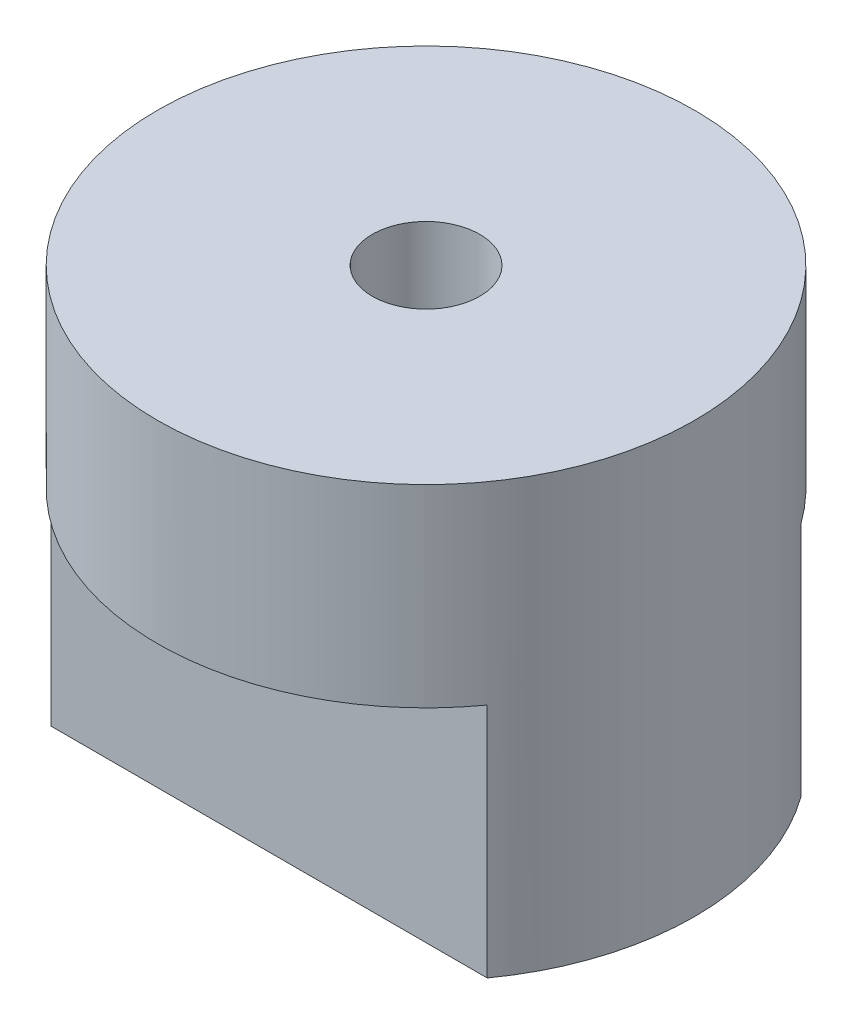
from build123d import *

# Parameters (mm, degrees)
SKETCH1_R               = 15.875
BOSS_EXTRUDE1_DEPTH     = 25.4
CUT_EXTRUDE1_DEPTH      = 34.89972345
CUT_EXTRUDE1_DEPTH_BACK = 34.89972345
SKETCH2_W               = 6.604
SKETCH2_H               = 13.97
SKETCH3_R               = 3.175
CUT_EXTRUDE2_DEPTH      = 12.7


with BuildPart() as part:
    # Sketch1 → Boss-Extrude1 (new body)
    with BuildSketch(Plane(origin=(0, 0, 0), x_dir=(1, 0, 0), z_dir=(0, 1, 0))):
        with Locations(Location((0, 0, 0), (0, 0, 270))):
            Circle(SKETCH1_R)
    extrude(amount=BOSS_EXTRUDE1_DEPTH)

    # Sketch2 → Cut-Extrude1 (cut, two sides: drawn at the far end of the back side and taken through both)
    with BuildSketch(Plane(origin=(0, 0, 0), x_dir=(0, 0, -1), z_dir=(1, 0, 0)).offset(-CUT_EXTRUDE1_DEPTH_BACK)):
        with Locations((12.573, 6.985)):
            Rectangle(SKETCH2_W, SKETCH2_H)
        with Locations((-12.573, 6.985)):
            Rectangle(SKETCH2_W, SKETCH2_H)
    extrude(amount=CUT_EXTRUDE1_DEPTH + CUT_EXTRUDE1_DEPTH_BACK, mode=Mode.SUBTRACT)

    # Sketch3 → Cut-Extrude2 (cut)
    with BuildSketch(Plane(origin=(0, 25.4, 0), x_dir=(1, 0, 0), z_dir=(0, 1, 0))):
        with Locations(Location((0, 0, 0), (0, 0, 270))):
            Circle(SKETCH3_R)
    extrude(amount=-CUT_EXTRUDE2_DEPTH, mode=Mode.SUBTRACT)


solid = part.part
